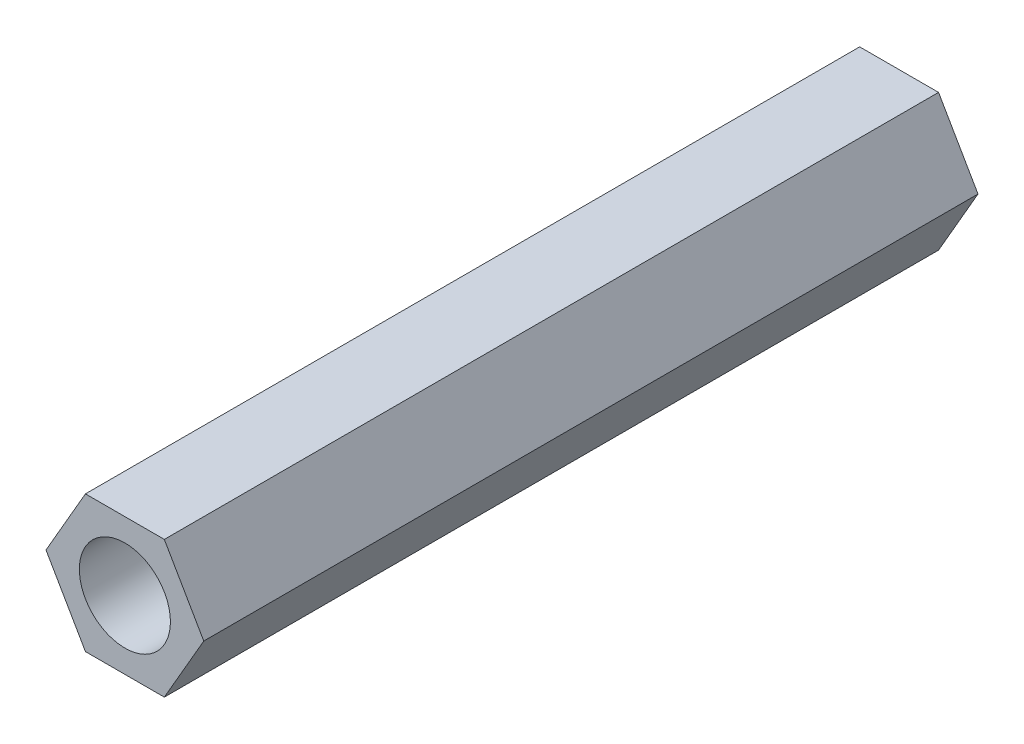
from build123d import *

# Parameters (mm, degrees)
SKETCH_1_R      = 1
EXTRUDE_1_DEPTH = 17


with BuildPart() as part:
    # 草图1 → 凸台-拉伸1 (new body)
    with BuildSketch(Plane.XY):
        Polygon((1.732050808, 0), (0.866025404, 1.5), (-0.866025404, 1.5), (-1.732050808, 0), (-0.866025404, -1.5), (0.866025404, -1.5), align=None)
        Circle(SKETCH_1_R, mode=Mode.SUBTRACT)
    extrude(amount=EXTRUDE_1_DEPTH)


solid = part.part
